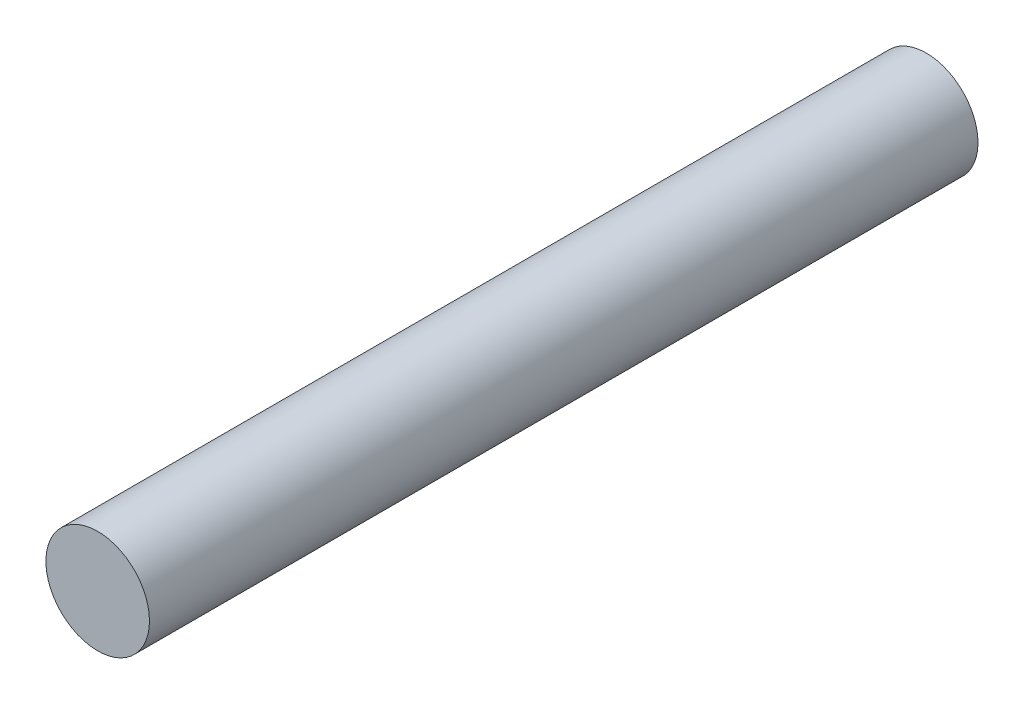
from build123d import *

# Parameters (mm, degrees)
SKETCH_1_R      = 3
EXTRUDE_1_DEPTH = 48


with BuildPart() as part:
    # 스케치1 → 보스-돌출1 (new body)
    with BuildSketch(Plane.XY):
        Circle(SKETCH_1_R)
    extrude(amount=EXTRUDE_1_DEPTH)


solid = part.part
